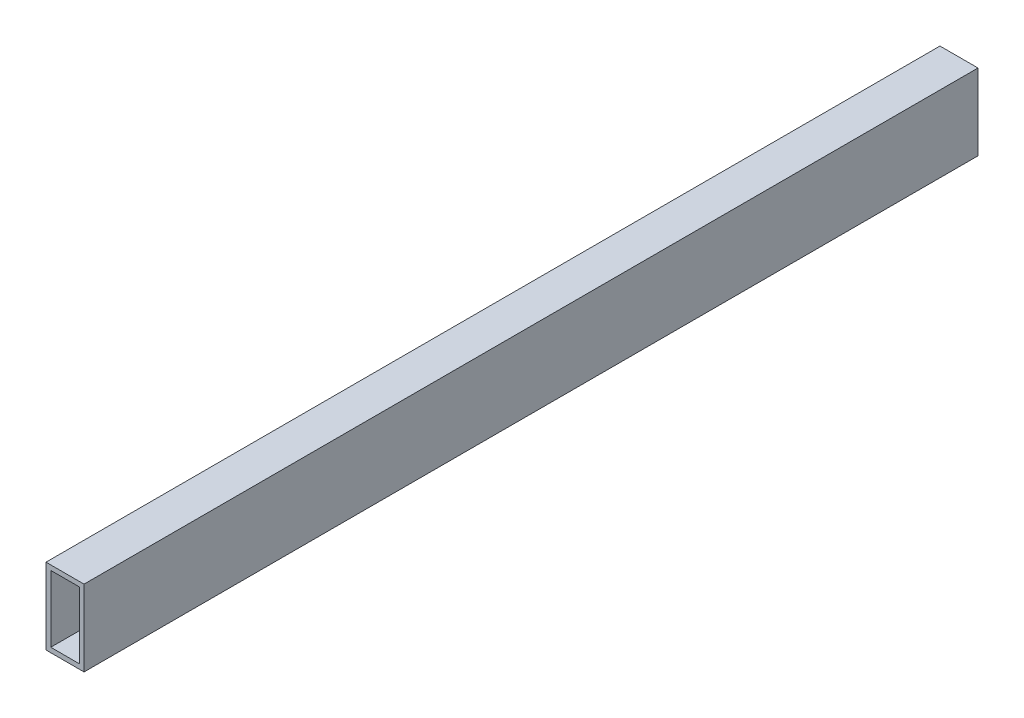
from build123d import *

# Parameters (mm, degrees)
SKETCH1_W           = 25.4
SKETCH1_H           = 50.8
SKETCH1_W_2         = 19.05
SKETCH1_H_2         = 44.45
BOSS_EXTRUDE1_DEPTH = 596.9


with BuildPart() as part:
    # Sketch1 → Boss-Extrude1 (new body)
    with BuildSketch(Plane.XY):
        with Locations((12.7, 25.4)):
            Rectangle(SKETCH1_W, SKETCH1_H)
        with Locations((12.7, 25.4)):
            Rectangle(SKETCH1_W_2, SKETCH1_H_2, mode=Mode.SUBTRACT)
    extrude(amount=BOSS_EXTRUDE1_DEPTH)


solid = part.part
